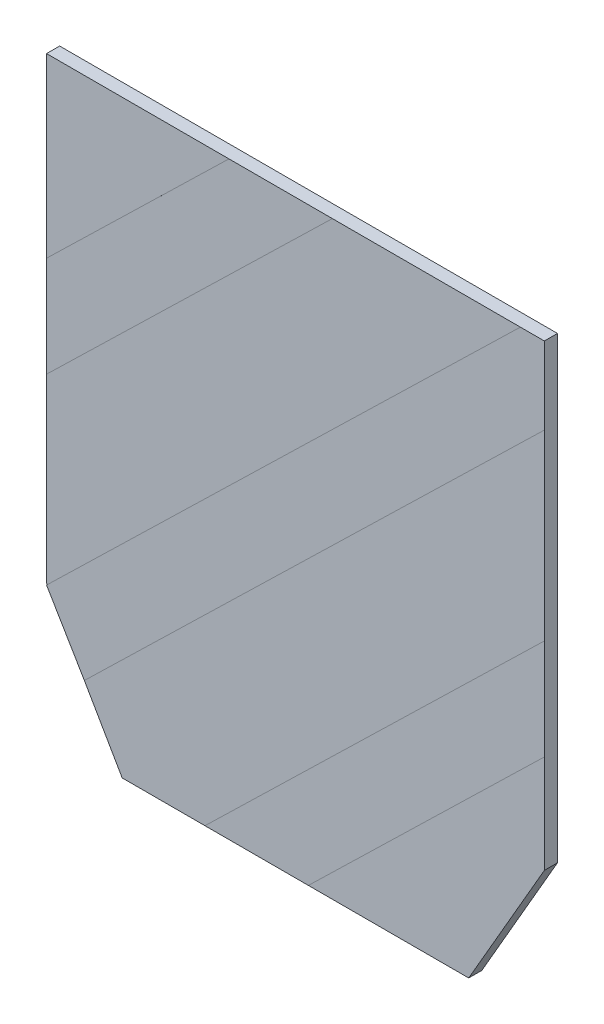
from build123d import *

# Parameters (mm, degrees)
BOSS_EXTRUDE1_DEPTH = 2
BOSS_EXTRUDE2_DEPTH = 0.0001


with BuildPart() as part:
    # Sketch1 → Boss-Extrude1 (new body)
    with BuildSketch(Plane.XY):
        Polygon((-38, -35), (-26.452994616, -55), (26.452994616, -55), (38, -35), (38, 35), (-38, 35), align=None)
    extrude(amount=BOSS_EXTRUDE1_DEPTH)

    # Sketch2 → Boss-Extrude2 (add)
    with BuildSketch(Plane.XY.offset(2)):
        Polygon((-38, 7.945483094), (-10.149076909, 35), (5.637899584, 35), (-38, -7.390059683), align=None)
        Polygon((-38, -35.272864732), (34.341493208, 35), (38, 35), (38, 23.218347826), (-32.226497308, -45), align=None)
        Polygon((-13.81727456, -55), (38, -4.664457223), (38, -20), (1.969701933, -55), align=None)
    extrude(amount=BOSS_EXTRUDE2_DEPTH)


solid = part.part
